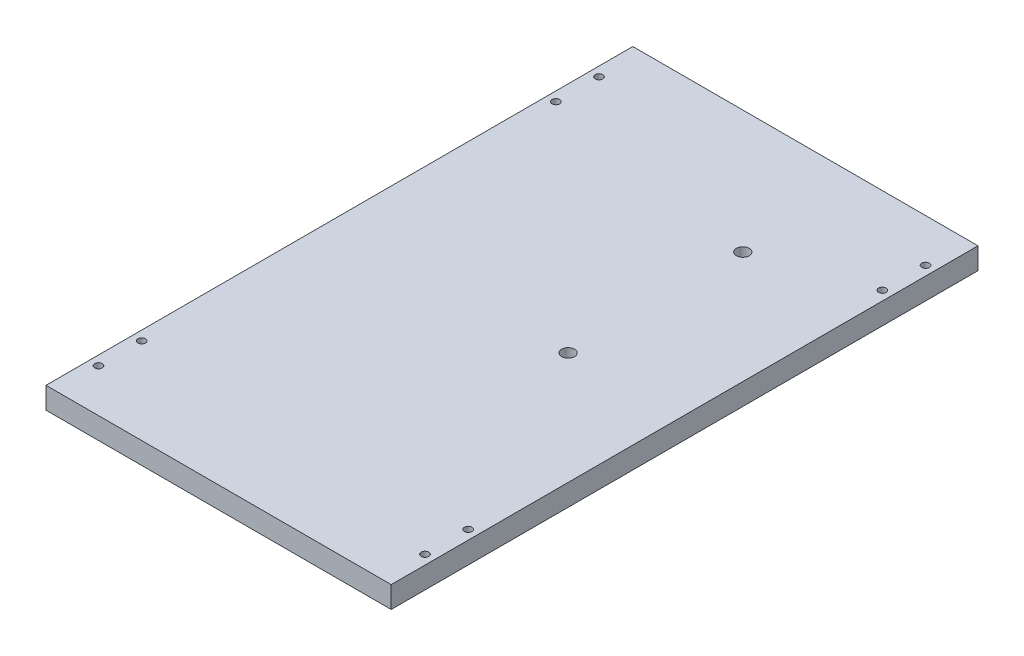
from build123d import *

# Parameters (mm, degrees)
SKETCH1_W           = 160
SKETCH1_H           = 272
SKETCH1_R           = 1.75
BOSS_EXTRUDE1_DEPTH = 10
SKETCH3_R           = 3
CUT_EXTRUDE1_DEPTH  = 18


with BuildPart() as part:
    # Sketch1 → Boss-Extrude1 (new body)
    with BuildSketch(Plane(origin=(0, 0, 0), x_dir=(1, 0, 0), z_dir=(0, 1, 0))):
        with Locations((80, 136)):
            Rectangle(SKETCH1_W, SKETCH1_H)
        with Locations(Location((4.328403696, 232, 0), (0, 0, 270))):
            Circle(SKETCH1_R, mode=Mode.SUBTRACT)
        with Locations(Location((4.328403696, 252, 0), (0, 0, 270))):
            Circle(SKETCH1_R, mode=Mode.SUBTRACT)
        with Locations(Location((4.328403696, 40, 0), (0, 0, 90))):
            Circle(SKETCH1_R, mode=Mode.SUBTRACT)
        with Locations(Location((4.328403696, 20, 0), (0, 0, 90))):
            Circle(SKETCH1_R, mode=Mode.SUBTRACT)
        with Locations(Location((155.671596304, 20, 0), (0, 0, 270))):
            Circle(SKETCH1_R, mode=Mode.SUBTRACT)
        with Locations(Location((155.671596304, 40, 0), (0, 0, 270))):
            Circle(SKETCH1_R, mode=Mode.SUBTRACT)
        with Locations(Location((155.671596304, 232, 0), (0, 0, 90))):
            Circle(SKETCH1_R, mode=Mode.SUBTRACT)
        with Locations(Location((155.671596304, 252, 0), (0, 0, 90))):
            Circle(SKETCH1_R, mode=Mode.SUBTRACT)
    extrude(amount=BOSS_EXTRUDE1_DEPTH)

    # Sketch3 → Cut-Extrude1 (cut)
    with BuildSketch(Plane(origin=(0, 10, 0), x_dir=(1, 0, 0), z_dir=(0, 1, 0))):
        with Locations(Location((108, 134, 0), (0, 0, 270))):
            Circle(SKETCH3_R)
        with Locations(Location((108, 215, 0), (0, 0, 270))):
            Circle(SKETCH3_R)
    extrude(amount=-CUT_EXTRUDE1_DEPTH, mode=Mode.SUBTRACT)


solid = part.part
